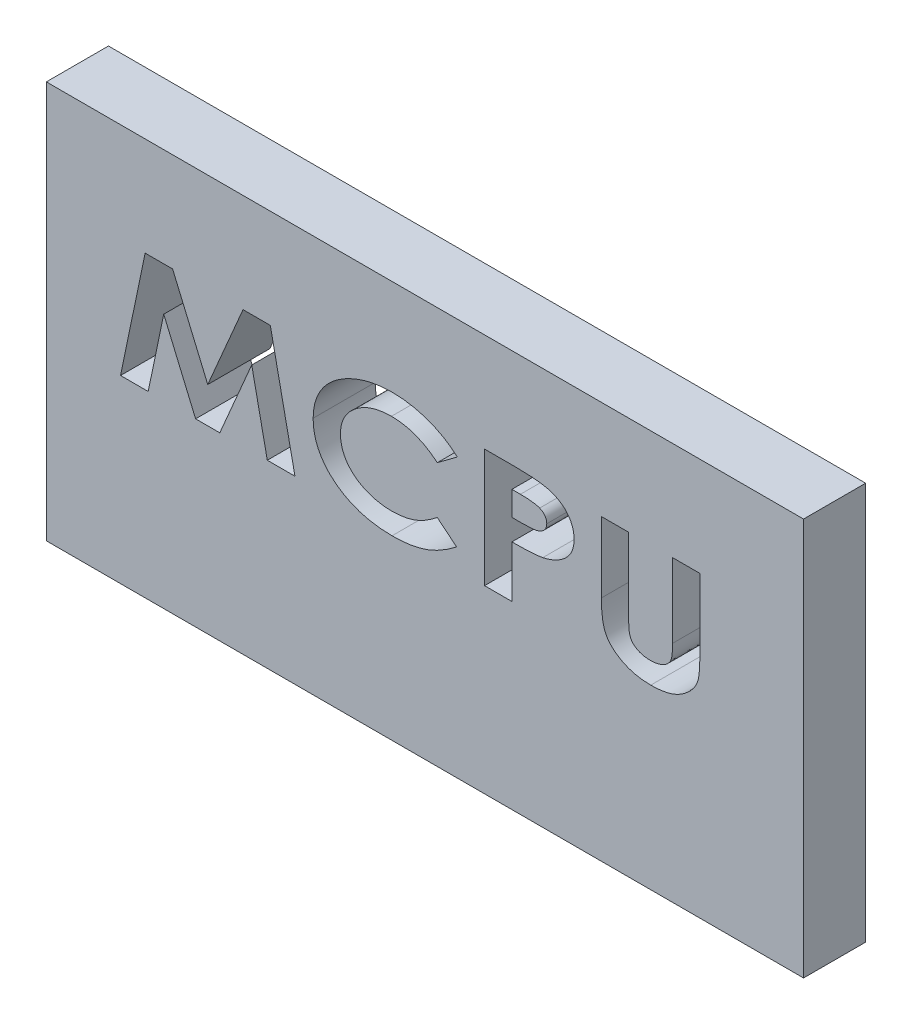
from build123d import *

# Parameters (mm, degrees)
SKETCH1_W           = 60.96
SKETCH1_H           = 32
BOSS_EXTRUDE1_DEPTH = 5
CUT_EXTRUDE1_DEPTH  = 70.029860206


with BuildPart() as part:
    # Sketch1 → Boss-Extrude1 (new body)
    with BuildSketch(Plane.XY):
        with Locations((30.48, 16)):
            Rectangle(SKETCH1_W, SKETCH1_H)
    extrude(amount=BOSS_EXTRUDE1_DEPTH)

    # Sketch2 → Cut-Extrude1 (cut, through all)
    # profile 1 of 4: a face of its own
    with BuildSketch(Plane.XY.offset(5)):
        Polygon((7.954510809, 24.037917062), (10.165944102, 24.037917062), (12.993678477, 17.394076918), (15.834769223, 24.037917062), (18.030938093, 24.037917062), (20.015313093, 14.512917062), (17.788615376, 14.512917062), (16.535024631, 20.529007807), (13.962969343, 14.512917062), (12.014847348, 14.512917062), (9.452332324, 20.529007807), (8.198741578, 14.512917062), (5.972043862, 14.512917062), align=None)
    # profile 2 of 4: a face of its own
    with BuildSketch(Plane.XY.offset(5)):
        with BuildLine():
            Line((33.081659247, 22.385543264), (31.473170665, 21.187286052))
            add(Edge.make_bspline(
                [(31.473170665, 21.187286052), (31.33625607, 21.297715975), (31.065961478, 21.515724953), (30.635280978, 21.798840943), (30.189674829, 22.035660675), (29.73386386, 22.234362101), (29.262984083, 22.384969773), (28.780509434, 22.494183694), (28.284788795, 22.561047897), (27.9498381, 22.568684892), (27.781088333, 22.572532447)],
                knots=[0, 0, 0, 0, 1.047498183, 2.067954082, 3.064716014, 4.050834122, 5.026236419, 6.005216353, 6.995018425, 8, 8, 8, 8], degree=3))
            add(Edge.make_bspline(
                [(27.781088333, 22.572532447), (27.639788721, 22.569487838), (27.361585812, 22.563493348), (26.953052922, 22.519601633), (26.56158799, 22.444369955), (26.186778139, 22.34280748), (25.829958815, 22.207349779), (25.48874493, 22.045735799), (25.165521075, 21.851764747), (24.86251171, 21.631871552), (24.584747188, 21.392367661), (24.342739033, 21.134021384), (24.139155434, 20.860666581), (23.969281402, 20.575798318), (23.837875589, 20.275283472), (23.747084826, 19.960201003), (23.689693102, 19.631764169), (23.682447351, 19.407946223), (23.678774631, 19.294497591)],
                knots=[0, 0, 0, 0, 1.161512295, 2.286885957, 3.372846391, 4.435843892, 5.47496362, 6.506332606, 7.535751468, 8.569066898, 9.580846572, 10.54639173, 11.472909722, 12.377706805, 13.267498426, 14.160969422, 15.067833891, 16, 16, 16, 16], degree=3))
            add(Edge.make_bspline(
                [(23.678774631, 19.294497591), (23.680058705, 19.214929364), (23.682592275, 19.057935472), (23.708232025, 18.825720128), (23.750175832, 18.600689319), (23.807657176, 18.382634838), (23.879679897, 18.17065425), (23.972624816, 17.966837444), (24.079047743, 17.768167118), (24.201213538, 17.577209892), (24.338917516, 17.395263336), (24.492165644, 17.224443849), (24.656687938, 17.060645792), (24.836051376, 16.908331688), (25.029827469, 16.767033211), (25.236312021, 16.635133763), (25.456351911, 16.513283481), (25.688180367, 16.400128798), (25.93204579, 16.3029734), (26.181992399, 16.213451519), (26.439925052, 16.141828196), (26.70377809, 16.083281023), (26.973365337, 16.033923593), (27.250770821, 16.003492867), (27.534561354, 15.980416587), (27.726340943, 15.979010727), (27.823065497, 15.978301677)],
                knots=[0, 0, 0, 0, 0.965450175, 1.904903346, 2.831518626, 3.741520969, 4.639923735, 5.545231674, 6.457065799, 7.37359341, 8.293787342, 9.223356292, 10.15679573, 11.109664492, 12.076225089, 13.065575861, 14.081553357, 15.127701224, 16.194242876, 17.266051707, 18.348703372, 19.440563194, 20.546010598, 21.673026615, 22.826384687, 24, 24, 24, 24], degree=3))
            add(Edge.make_bspline(
                [(27.823065497, 15.978301677), (27.986031742, 15.982055774), (28.306562594, 15.989439536), (28.776056657, 16.044848187), (29.223974863, 16.139235536), (29.583408494, 16.247587348), (29.865548024, 16.357231151), (30.079898059, 16.457285766), (30.300438146, 16.570023703), (30.525429436, 16.698558163), (30.756812452, 16.840932517), (30.990436166, 17.002764083), (31.231890842, 17.17578223), (31.391541831, 17.300023876), (31.473170665, 17.363548072)],
                knots=[0, 0, 0, 0, 1.46963059, 2.890549154, 4.256359375, 5.593721101, 6.271220114, 6.984770085, 7.726205572, 8.504599441, 9.321221579, 10.175632609, 11.067209143, 12, 12, 12, 12], degree=3))
            Line((31.473170665, 17.363548072), (33.032049872, 16.087060692))
            add(Edge.make_bspline(
                [(33.032049872, 16.087060692), (32.922485201, 16.00438673), (32.707564481, 15.842214495), (32.383319975, 15.61419324), (32.061731256, 15.409030539), (31.747647004, 15.218642645), (31.436428543, 15.050140621), (31.128424907, 14.904285447), (30.827354636, 14.772396022), (30.52653358, 14.663817549), (30.223756413, 14.568550548), (29.911983007, 14.489294946), (29.59068305, 14.420345604), (29.258223119, 14.365350871), (28.916514709, 14.321218291), (28.563795137, 14.291580306), (28.201099237, 14.271296938), (27.955386176, 14.269565116), (27.830697708, 14.268686293)],
                knots=[0, 0, 0, 0, 1.170168288, 2.295387817, 3.378357592, 4.421752238, 5.426193512, 6.393913974, 7.32663767, 8.227237166, 9.119060518, 10.031788755, 10.968742797, 11.91991457, 12.903890504, 13.90538553, 14.937076171, 16, 16, 16, 16], degree=3))
            add(Edge.make_bspline(
                [(27.830697708, 14.268686293), (27.602856807, 14.273250497), (27.157040601, 14.282181273), (26.504336174, 14.347094198), (25.883676572, 14.457712039), (25.294265925, 14.611570783), (24.736184431, 14.810632024), (24.209491516, 15.053083428), (23.714774276, 15.340277099), (23.330971694, 15.616284027), (23.043684534, 15.854516837), (22.842187374, 16.040918354), (22.654363765, 16.232591564), (22.478915098, 16.429422552), (22.320640162, 16.635232358), (22.174038702, 16.84553331), (22.041248116, 17.062680003), (21.923398829, 17.286001712), (21.817691495, 17.514854103), (21.72838164, 17.750456425), (21.651634777, 17.991787982), (21.588409586, 18.239482977), (21.54124241, 18.493940975), (21.506979629, 18.75378418), (21.485347911, 19.020010594), (21.482260967, 19.19969006), (21.480697708, 19.290681485)],
                knots=[0, 0, 0, 0, 1.811886863, 3.545318357, 5.210258498, 6.821188673, 8.384332979, 9.916537402, 11.426114527, 12.926732761, 13.670233396, 14.393304328, 15.108691124, 15.80390781, 16.48889144, 17.172229551, 17.841952478, 18.511732709, 19.179446893, 19.845492101, 20.514182713, 21.192616893, 21.877152137, 22.571079508, 23.276380798, 24, 24, 24, 24], degree=3))
            add(Edge.make_bspline(
                [(21.480697708, 19.290681485), (21.483387423, 19.407807097), (21.488722658, 19.640133887), (21.527464535, 19.982767766), (21.591038187, 20.315585335), (21.677665411, 20.63849786), (21.79415406, 20.951005755), (21.932069527, 21.254311961), (22.098676044, 21.546080554), (22.286996967, 21.828723114), (22.500538052, 22.098878571), (22.737230141, 22.355732414), (22.994266567, 22.600658658), (23.276045267, 22.82844434), (23.576579124, 23.04563216), (23.900015026, 23.247780638), (24.245713475, 23.436162736), (24.610526703, 23.610965787), (24.990048479, 23.768524359), (25.379331548, 23.905776195), (25.775430082, 24.022457568), (26.178378679, 24.118732943), (26.589674075, 24.189801098), (27.007738712, 24.244564158), (27.433383653, 24.274525371), (27.719352956, 24.279597587), (27.863134607, 24.282147831)],
                knots=[0, 0, 0, 0, 0.935710299, 1.856046398, 2.751032788, 3.641086013, 4.523738995, 5.41281973, 6.300301529, 7.20514491, 8.124189388, 9.04851525, 9.993890135, 10.958196572, 11.941188203, 12.954947156, 14.003331554, 15.085245736, 16.185631645, 17.284972737, 18.38160913, 19.483542832, 20.593043469, 21.714996232, 22.851129778, 24, 24, 24, 24], degree=3))
            add(Edge.make_bspline(
                [(27.863134607, 24.282147831), (27.985923036, 24.280691668), (28.231075753, 24.277784373), (28.596456331, 24.254018231), (28.958899783, 24.216737438), (29.316876376, 24.159910454), (29.672721767, 24.09294103), (30.02394737, 24.004923758), (30.373195793, 23.907898727), (30.716047087, 23.789803397), (31.052428331, 23.6622282), (31.377028148, 23.51786734), (31.691771821, 23.363605366), (31.993490526, 23.194504061), (32.283530087, 23.011831269), (32.561991668, 22.817301053), (32.830022296, 22.610345684), (32.997930407, 22.460343271), (33.081659247, 22.385543264)],
                knots=[0, 0, 0, 0, 1.037918018, 2.072250816, 3.094113102, 4.116880266, 5.1354982, 6.153960031, 7.176840249, 8.198702535, 9.218185693, 10.217217538, 11.200675921, 12.180379311, 13.139566827, 14.097155671, 15.051130131, 16, 16, 16, 16], degree=3))
        make_face()
    # profile 3 of 4: a face of its own
    with BuildSketch(Plane.XY.offset(5)):
        with BuildLine():
            Line((35.27973617, 24.037917062), (37.727768021, 24.037917062))
            add(Edge.make_bspline(
                [(37.727768021, 24.037917062), (37.887416726, 24.037364977), (38.195327383, 24.036300184), (38.640063911, 24.023153943), (39.050352709, 23.999944737), (39.42597331, 23.970962152), (39.766952812, 23.930264851), (40.073539825, 23.884259053), (40.345775447, 23.827645774), (40.586666668, 23.760237455), (40.80381065, 23.681662516), (41.007799799, 23.597151905), (41.197345769, 23.496323246), (41.379060977, 23.390541555), (41.546119939, 23.269998272), (41.702023127, 23.138918969), (41.847439822, 22.998480089), (41.978945102, 22.845345081), (42.096670858, 22.683736127), (42.20131011, 22.514661761), (42.288658952, 22.336757896), (42.361807717, 22.151360881), (42.417497514, 21.957749767), (42.454316035, 21.755662788), (42.480915044, 21.546701261), (42.483325979, 21.404254813), (42.484543862, 21.332298072)],
                knots=[0, 0, 0, 0, 1.855107689, 3.577902052, 5.169361155, 6.630109933, 7.954766161, 9.158917748, 10.231552938, 11.183798028, 12.062755255, 12.913834021, 13.746847176, 14.555505333, 15.355368483, 16.136995589, 16.920960237, 17.701748312, 18.479311714, 19.242374405, 20.009185935, 20.77912529, 21.55573978, 22.345708185, 23.164335441, 24, 24, 24, 24], degree=3))
            add(Edge.make_bspline(
                [(42.484543862, 21.332298072), (42.482050387, 21.252714727), (42.477144768, 21.096143891), (42.447219553, 20.866313229), (42.392994013, 20.647216593), (42.318378159, 20.438072781), (42.222830367, 20.238948003), (42.105325676, 20.050035142), (41.965504136, 19.873114451), (41.805891939, 19.706344248), (41.629172584, 19.55133456), (41.437333211, 19.406523043), (41.228223779, 19.277470984), (41.004877075, 19.159480129), (40.766790202, 19.051761969), (40.51365538, 18.957247492), (40.245037098, 18.873856342), (40.059095861, 18.831508654), (39.964006001, 18.809852158)],
                knots=[0, 0, 0, 0, 0.983245981, 1.934420402, 2.856730671, 3.766303004, 4.672952299, 5.579907935, 6.508820747, 7.45354822, 8.427711485, 9.40982672, 10.419219512, 11.459572099, 12.528575546, 13.644949869, 14.795633565, 16, 16, 16, 16], degree=3))
            add(Edge.make_bspline(
                [(39.964006001, 18.809852158), (39.901154655, 18.797691391), (39.76462442, 18.771274895), (39.540755881, 18.744811121), (39.282492305, 18.719946311), (38.989217589, 18.699002526), (38.6608951, 18.684681929), (38.297700153, 18.673387375), (37.899528652, 18.66528679), (37.622193483, 18.664993056), (37.477813093, 18.664840139)],
                knots=[0, 0, 0, 0, 0.615940763, 1.337991025, 2.168184893, 3.113261968, 4.167258378, 5.33087916, 6.610458565, 8, 8, 8, 8], degree=3))
            Line((37.477813093, 18.664840139), (37.477813093, 14.512917062))
            Line((37.477813093, 14.512917062), (35.27973617, 14.512917062))
            Line((35.27973617, 14.512917062), (35.27973617, 24.037917062))
        make_face()
        with BuildLine():
            Line((37.477813093, 20.374455524), (38.252482564, 20.374455524))
            add(Edge.make_bspline(
                [(38.252482564, 20.374455524), (38.325625886, 20.374971293), (38.466197721, 20.375962534), (38.668493805, 20.379306869), (38.853035718, 20.386444655), (39.020237604, 20.398721245), (39.16998287, 20.410602062), (39.302771494, 20.428812215), (39.418435018, 20.446218892), (39.547316388, 20.476868955), (39.688379558, 20.523776249), (39.839520352, 20.597300928), (39.972499007, 20.684368917), (40.084690048, 20.788832149), (40.175643281, 20.906723912), (40.239198898, 21.039456271), (40.278946803, 21.183099392), (40.283921659, 21.283062235), (40.286466939, 21.334206125)],
                knots=[0, 0, 0, 0, 1.392285696, 2.675789788, 3.851106149, 4.906862521, 5.867013269, 6.709429052, 7.457775361, 8.092061581, 9.229094434, 10.279492485, 11.283446023, 12.242833232, 13.184721612, 14.099774538, 15.027789537, 16, 16, 16, 16], degree=3))
            add(Edge.make_bspline(
                [(40.286466939, 21.334206125), (40.284608486, 21.378869508), (40.280989237, 21.465849295), (40.253561175, 21.591346403), (40.209227366, 21.708120819), (40.146275664, 21.816007717), (40.062268006, 21.911437165), (39.963013682, 21.998702943), (39.846427543, 22.077998466), (39.757997384, 22.118436039), (39.712143021, 22.139404442)],
                knots=[0, 0, 0, 0, 1.01607562, 1.978758329, 2.909106172, 3.850207249, 4.805018697, 5.789768104, 6.853911621, 8, 8, 8, 8], degree=3))
            add(Edge.make_bspline(
                [(39.712143021, 22.139404442), (39.673596151, 22.154763414), (39.590865046, 22.187727564), (39.451883811, 22.22460328), (39.291894093, 22.256509072), (39.109710722, 22.282929339), (38.905346831, 22.303324505), (38.678197184, 22.318943087), (38.428691614, 22.325189934), (38.255027182, 22.327237059), (38.164712131, 22.328301677)],
                knots=[0, 0, 0, 0, 0.634816011, 1.362472005, 2.197016134, 3.132082461, 4.179500588, 5.340894497, 6.617118958, 8, 8, 8, 8], degree=3))
            Line((38.164712131, 22.328301677), (37.477813093, 22.328301677))
            Line((37.477813093, 22.328301677), (37.477813093, 20.374455524))
        make_face(mode=Mode.SUBTRACT)
    # profile 4 of 4: a face of its own
    with BuildSketch(Plane.XY.offset(5)):
        with BuildLine():
            Line((44.682620785, 24.037917062), (46.880697708, 24.037917062))
            Line((46.880697708, 24.037917062), (46.880697708, 17.840561293))
            add(Edge.make_bspline(
                [(46.880697708, 17.840561293), (46.880659686, 17.776304305), (46.880586228, 17.652162176), (46.891326944, 17.474071054), (46.903720685, 17.310378972), (46.922841173, 17.161385077), (46.946733656, 17.026081234), (46.977874575, 16.905990173), (47.010369351, 16.799398735), (47.068068798, 16.679914763), (47.152652868, 16.543484547), (47.289133913, 16.404206873), (47.44767872, 16.276396333), (47.636780182, 16.169972781), (47.850133275, 16.085635489), (48.085334091, 16.021393399), (48.341865059, 15.986550521), (48.519617735, 15.981108595), (48.611301675, 15.978301677)],
                knots=[0, 0, 0, 0, 1.042330976, 2.013744964, 2.893880655, 3.705397848, 4.450270186, 5.121044372, 5.718245416, 6.253772157, 7.270030384, 8.30662409, 9.400940003, 10.565730178, 11.811328046, 13.115564187, 14.512222457, 16, 16, 16, 16], degree=3))
            add(Edge.make_bspline(
                [(48.611301675, 15.978301677), (48.708796937, 15.980439996), (48.897132848, 15.984570682), (49.168934389, 16.02839506), (49.42093172, 16.095330981), (49.649004949, 16.193236785), (49.851034568, 16.309698228), (50.020986463, 16.443915203), (50.158963689, 16.592475863), (50.244234863, 16.734643758), (50.298059674, 16.862217157), (50.331449749, 16.977565622), (50.360015578, 17.112114692), (50.381420866, 17.265909694), (50.401248644, 17.438868675), (50.413790184, 17.631152994), (50.421520085, 17.84303895), (50.421864358, 17.99065357), (50.422043862, 18.067619586)],
                knots=[0, 0, 0, 0, 1.444790072, 2.790964898, 4.072527466, 5.302503052, 6.460906732, 7.521628549, 8.503271233, 9.451296571, 9.962868575, 10.553781864, 11.229096548, 12.001525687, 12.855738701, 13.810777885, 14.858543254, 16, 16, 16, 16], degree=3))
            Line((50.422043862, 18.067619586), (50.422043862, 24.037917062))
            Line((50.422043862, 24.037917062), (52.620120785, 24.037917062))
            Line((52.620120785, 24.037917062), (52.620120785, 18.355735572))
            add(Edge.make_bspline(
                [(52.620120785, 18.355735572), (52.619295699, 18.240609968), (52.61770905, 18.019222393), (52.60830199, 17.701129099), (52.593108742, 17.410392486), (52.573359088, 17.147409393), (52.54459617, 16.911939938), (52.510556527, 16.703735948), (52.472402284, 16.5220355), (52.407418817, 16.315790791), (52.301780731, 16.076713047), (52.130304106, 15.80471954), (51.917042276, 15.535635182), (51.659469066, 15.279018255), (51.371340996, 15.039389003), (51.058297859, 14.826387067), (50.721372582, 14.651754053), (50.362280238, 14.508831396), (49.977984651, 14.399917414), (49.564448138, 14.32556438), (49.121947138, 14.276119003), (48.816241627, 14.271210807), (48.659002997, 14.268686293)],
                knots=[0, 0, 0, 0, 1.048465452, 2.016208535, 2.897852646, 3.699721694, 4.417449558, 5.057358133, 5.620907919, 6.10638888, 7.024441343, 7.992080414, 9.026953953, 10.145102751, 11.296847888, 12.435865683, 13.58618256, 14.745679343, 15.950263297, 17.216971339, 18.568558298, 20, 20, 20, 20], degree=3))
            add(Edge.make_bspline(
                [(48.659002997, 14.268686293), (48.554647499, 14.270059097), (48.348860505, 14.272766241), (48.04520656, 14.296990014), (47.75141171, 14.332082756), (47.468452034, 14.383551175), (47.195867263, 14.450912033), (46.932990998, 14.532160916), (46.680919159, 14.629918849), (46.440807679, 14.740390867), (46.213884937, 14.862068058), (46.003118681, 14.993849703), (45.807154689, 15.130068544), (45.630903833, 15.277423955), (45.468096308, 15.428258199), (45.324292606, 15.589675692), (45.198106532, 15.75869064), (45.083983335, 15.936973858), (44.986687148, 16.13635235), (44.906111561, 16.363352128), (44.835304255, 16.620198743), (44.77944181, 16.907999794), (44.736329088, 17.226602465), (44.704169373, 17.575425228), (44.685196795, 17.955467698), (44.683500973, 18.218969429), (44.682620785, 18.355735572)],
                knots=[0, 0, 0, 0, 1.139223061, 2.246525513, 3.324074361, 4.368811041, 5.384430518, 6.388205074, 7.370907534, 8.334155974, 9.272474927, 10.180097188, 11.047120909, 11.875808385, 12.686403601, 13.468414007, 14.232299858, 14.987551083, 15.776407491, 16.648561, 17.613934854, 18.683036789, 19.846822431, 21.123122364, 22.506805041, 24, 24, 24, 24], degree=3))
            Line((44.682620785, 18.355735572), (44.682620785, 24.037917062))
        make_face()
    extrude(amount=-CUT_EXTRUDE1_DEPTH, mode=Mode.SUBTRACT)


with BuildPart() as cut_extrude1_piece_1:
    # of the separate pieces the step leaves, piece 1, a body of its own (cut_extrude1_pieces)
    add(part.part.solids().sort_by_distance((0, 0, 0))[0])


with BuildPart() as cut_extrude1_piece_2:
    # of the separate pieces the step leaves, piece 2, a body of its own (cut_extrude1_pieces)
    add(part.part.solids().sort_by_distance((40.286466939, 21.334206125, 0))[0])


solid = Compound([cut_extrude1_piece_1.part, cut_extrude1_piece_2.part])
